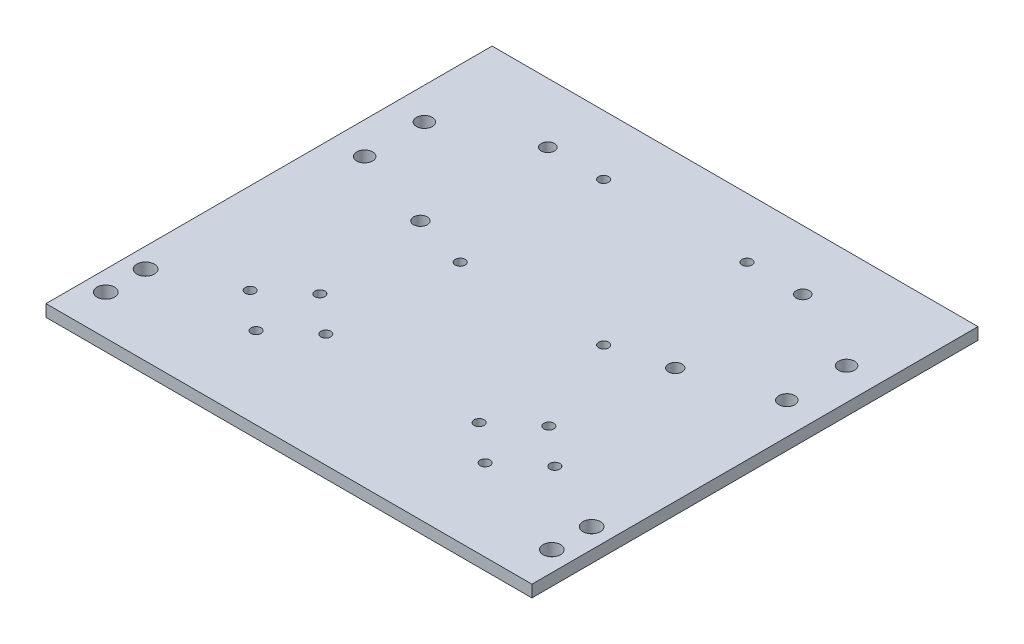
from build123d import *

# Parameters (mm, degrees)
SKETCH1_W           = 122
SKETCH1_H           = 112
BOSS_EXTRUDE1_DEPTH = 3
SKETCH3_R           = 2
CUT_EXTRUDE2_DEPTH  = 10
SKETCH4_R           = 1.25
CUT_EXTRUDE3_DEPTH  = 23
SKETCH5_R           = 1.25
CUT_EXTRUDE4_DEPTH  = 23
SKETCH6_R           = 1.65
SKETCH6_R_2         = 1.722739023
CUT_EXTRUDE5_DEPTH  = 10
SKETCH7_R           = 2.2
CUT_EXTRUDE6_DEPTH  = 10


with BuildPart() as part:
    # Sketch1 → Boss-Extrude1 (new body)
    with BuildSketch(Plane(origin=(0, 0, 0), x_dir=(1, 0, 0), z_dir=(0, 1, 0))):
        Rectangle(SKETCH1_W, SKETCH1_H)
    extrude(amount=BOSS_EXTRUDE1_DEPTH)

    # Sketch3 → Cut-Extrude2 (cut)
    with BuildSketch(Plane(origin=(0, 3, 0), x_dir=(1, 0, 0), z_dir=(0, 1, 0))):
        with Locations(Location((-53, 31, 0), (0, 0, 270))):
            Circle(SKETCH3_R)
        with Locations(Location((-53, 16, 0), (0, 0, 270))):
            Circle(SKETCH3_R)
        with Locations(Location((53, 16, 0), (0, 0, 270))):
            Circle(SKETCH3_R)
        with Locations(Location((53, 31, 0), (0, 0, 270))):
            Circle(SKETCH3_R)
    extrude(amount=-CUT_EXTRUDE2_DEPTH, mode=Mode.SUBTRACT)

    # Sketch4 → Cut-Extrude3 (cut)
    with BuildSketch(Plane(origin=(0, 3, 0), x_dir=(1, 0, 0), z_dir=(0, 1, 0))):
        with Locations(Location((-18, 41, 0), (0, 0, 270))):
            Circle(SKETCH4_R)
        with Locations(Location((-18, 5, 0), (0, 0, 270))):
            Circle(SKETCH4_R)
        with Locations(Location((18, 5, 0), (0, 0, 270))):
            Circle(SKETCH4_R)
        with Locations(Location((18, 41, 0), (0, 0, 270))):
            Circle(SKETCH4_R)
    extrude(amount=-CUT_EXTRUDE3_DEPTH, mode=Mode.SUBTRACT)

    # Sketch5 → Cut-Extrude4 (cut)
    with BuildSketch(Plane(origin=(0, 3, 0), x_dir=(1, 0, 0), z_dir=(0, 1, 0))):
        with Locations(Location((-38.25, -27.5, 0), (0, 0, 270))):
            Circle(SKETCH5_R)
        with Locations(Location((-28.75, -19.5, 0), (0, 0, 270))):
            Circle(SKETCH5_R)
        with Locations(Location((-28.75, -35.5, 0), (0, 0, 270))):
            Circle(SKETCH5_R)
        with Locations(Location((-19.25, -27.5, 0), (0, 0, 270))):
            Circle(SKETCH5_R)
        with Locations(Location((38.25, -27.5, 0), (0, 0, 270))):
            Circle(SKETCH5_R)
        with Locations(Location((19.25, -27.5, 0), (0, 0, 270))):
            Circle(SKETCH5_R)
        with Locations(Location((28.75, -35.5, 0), (0, 0, 270))):
            Circle(SKETCH5_R)
        with Locations(Location((28.75, -19.5, 0), (0, 0, 270))):
            Circle(SKETCH5_R)
    extrude(amount=-CUT_EXTRUDE4_DEPTH, mode=Mode.SUBTRACT)

    # Sketch6 → Cut-Extrude5 (cut)
    with BuildSketch(Plane(origin=(0, 3, 0), x_dir=(1, 0, 0), z_dir=(0, 1, 0))):
        with Locations(Location((-32, 41, 0), (0, 0, 270))):
            Circle(SKETCH6_R)
        with Locations(Location((-32, 9, 0), (0, 0, 270))):
            Circle(SKETCH6_R_2)
        with Locations(Location((32, 9, 0), (0, 0, 270))):
            Circle(SKETCH6_R_2)
        with Locations(Location((32, 41, 0), (0, 0, 270))):
            Circle(SKETCH6_R)
    extrude(amount=-CUT_EXTRUDE5_DEPTH, mode=Mode.SUBTRACT)

    # Sketch7 → Cut-Extrude6 (cut)
    with BuildSketch(Plane(origin=(0, 3, 0), x_dir=(1, 0, 0), z_dir=(0, 1, 0))):
        with Locations(Location((-56, -46, 0), (0, 0, 270))):
            Circle(SKETCH7_R)
        with Locations(Location((-56, -36, 0), (0, 0, 270))):
            Circle(SKETCH7_R)
    cut_extrude6 = extrude(amount=-CUT_EXTRUDE6_DEPTH, mode=Mode.SUBTRACT)

    # Mirror1: Cut-Extrude6 across plane
    add(cut_extrude6.mirror(Plane(origin=(0, 0, 0), x_dir=(0, 0, 1), z_dir=(1, 0, 0))), mode=Mode.SUBTRACT)


solid = part.part
